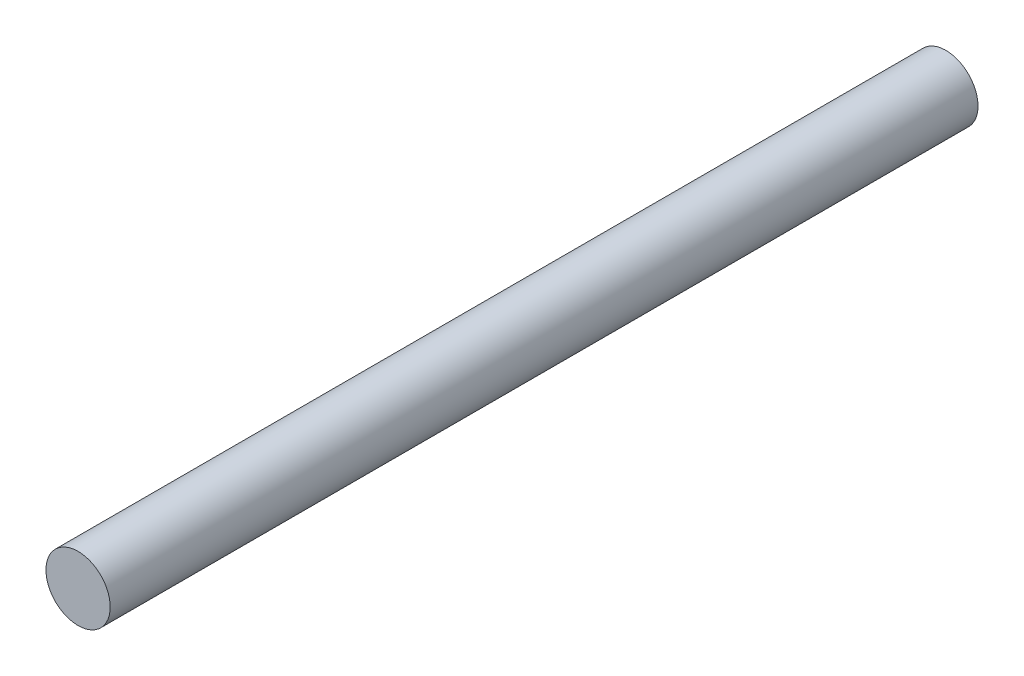
from build123d import *

# Parameters (mm, degrees)
SKETCH_1_R      = 5
EXTRUDE_1_DEPTH = 135


with BuildPart() as part:
    # 草图1 → 凸台-拉伸1 (new body)
    with BuildSketch(Plane.XY):
        Circle(SKETCH_1_R)
    extrude(amount=EXTRUDE_1_DEPTH)


solid = part.part
